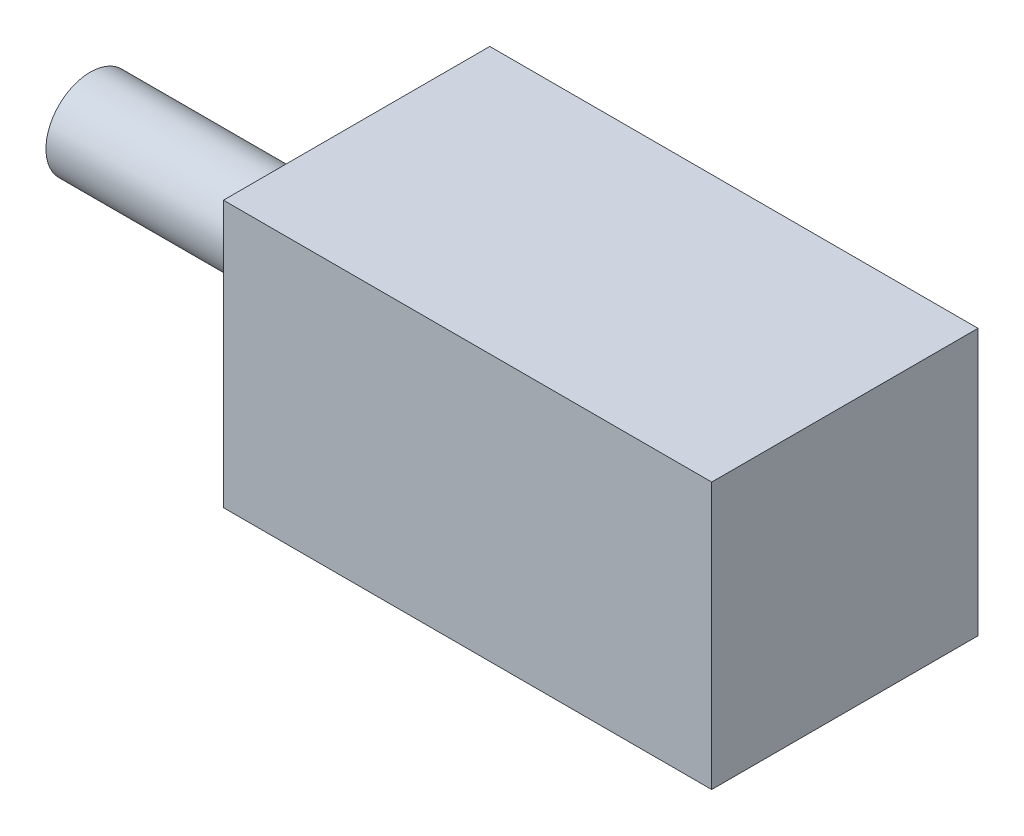
from build123d import *

# Parameters (mm, degrees)
BOSS_EXTRUDE1_DEPTH      = 19.05
BOSS_EXTRUDE1_DEPTH_BACK = 19.05
SKETCH1_W                = 69.85
SKETCH1_H                = 38.1
SKETCH3_W                = 38.1
SKETCH3_H                = 6.35


with BuildPart() as part:
    # Sketch1 → Boss-Extrude1 (new, two sides: drawn at the far end of the back side and taken through both)
    with BuildSketch(Plane(origin=(0, 0, 0), x_dir=(1, 0, 0), z_dir=(0, 1, 0)).offset(-BOSS_EXTRUDE1_DEPTH_BACK)):
        with Locations((34.925, 0)):
            Rectangle(SKETCH1_W, SKETCH1_H)
    extrude(amount=BOSS_EXTRUDE1_DEPTH + BOSS_EXTRUDE1_DEPTH_BACK)

    # Sketch3 → Revolve1 (revolve)
    with BuildSketch(Plane(origin=(0, 0, 0), x_dir=(1, 0, 0), z_dir=(0, 1, 0))):
        with Locations((-19.05, 3.175)):
            Rectangle(SKETCH3_W, SKETCH3_H)
    revolve(axis=Axis((0, 0, 0), (-1, 0, 0)))


solid = part.part
